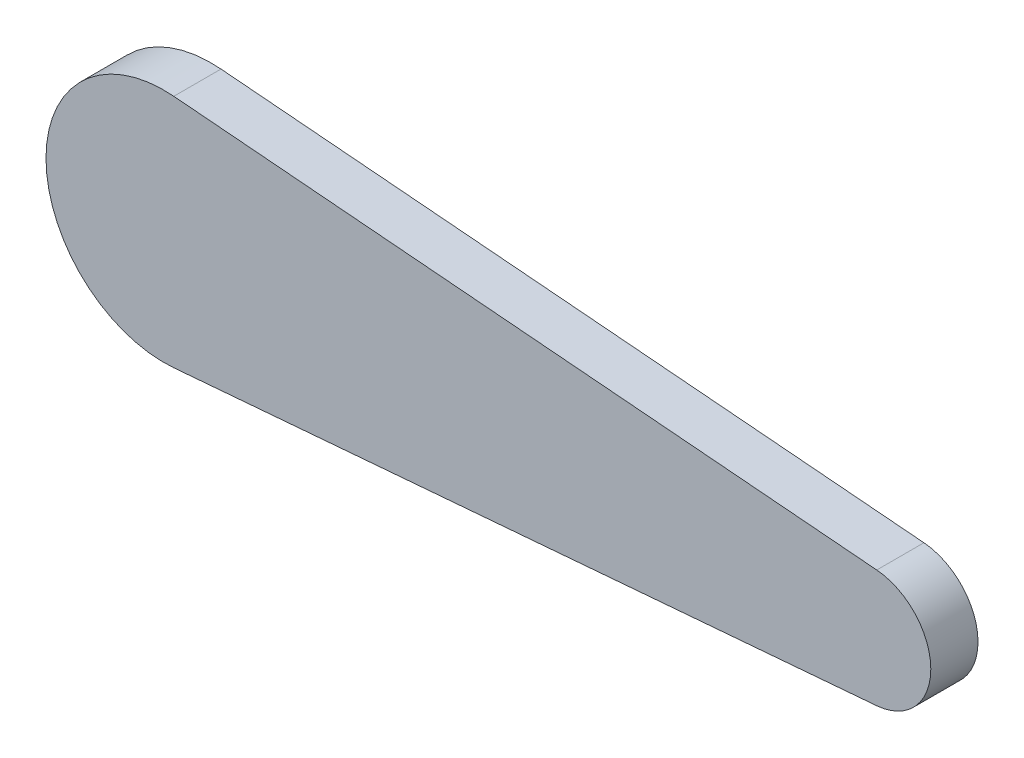
from build123d import *

# Parameters (mm, degrees)
SKETCH_1_R      = 50
SKETCH_1_R_2    = 25
EXTRUDE_1_DEPTH = 20
SKETCH_2_R      = 25
EXTRUDE_2_DEPTH = 20


with BuildPart() as part:
    # 草图1 → 凸台-拉伸1 (new body)
    with BuildSketch(Plane.XY):
        Circle(SKETCH_1_R)
        with BuildLine():
            Line((302.083333333, 24.913043215), (4.166666667, 49.82608643))
            ThreePointArc((4.166666667, 49.82608643), (36.79900361, 33.850160019), (50, 0))
            ThreePointArc((50, 0), (36.79900361, -33.850160019), (4.166666667, -49.82608643))
            Line((4.166666667, -49.82608643), (302.083333333, -24.913043215))
            ThreePointArc((302.083333333, -24.913043215), (275, 0), (302.083333333, 24.913043215))
        make_face()
        with Locations((300, 0)):
            Circle(SKETCH_1_R_2)
    extrude(amount=EXTRUDE_1_DEPTH)

    # 草图2 → 凸台-拉伸2 (add)
    with BuildSketch(Plane(origin=(0, 0, 0), x_dir=(-1, 0, 0), z_dir=(0, 0, -1))):
        with Locations(Location((0, 0, 0), (0, 0, 180))):
            Circle(SKETCH_2_R)
    extrude(amount=EXTRUDE_2_DEPTH)


solid = part.part
